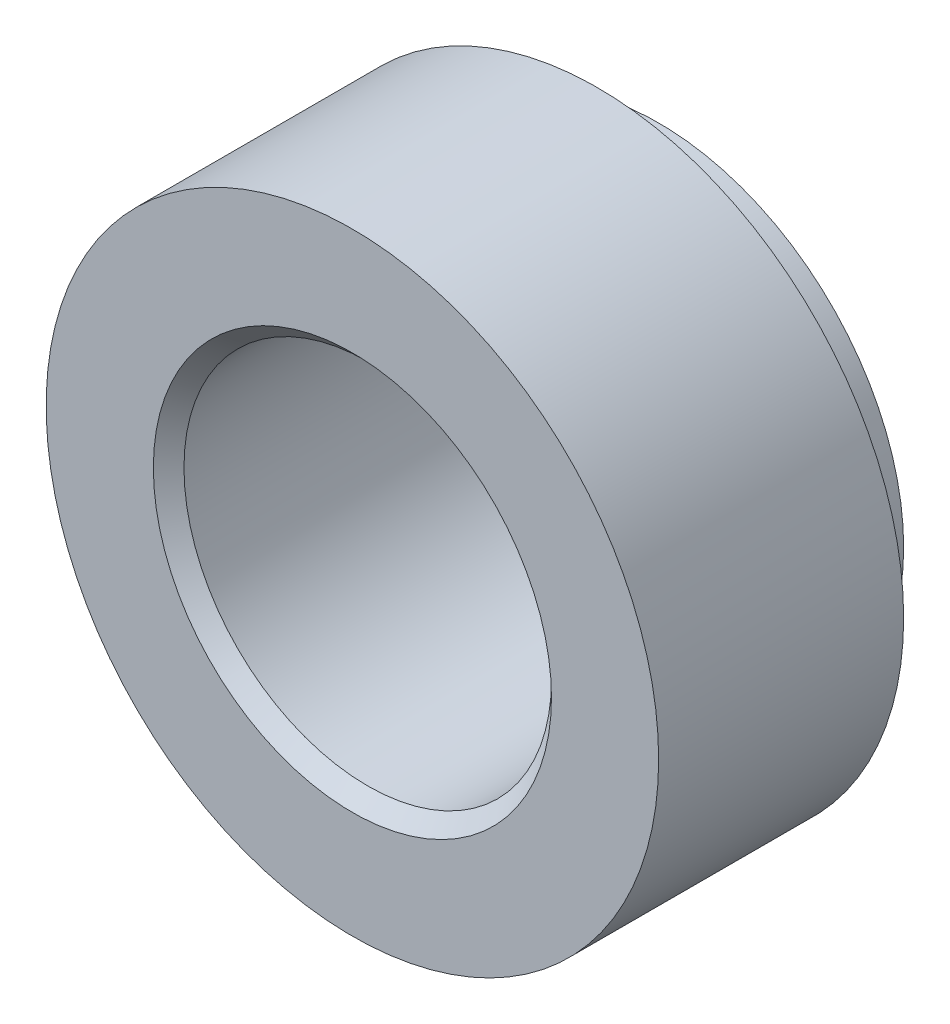
from build123d import *

# Parameters (mm, degrees)
CHAMFER1_SIZE = 1.5875


with BuildPart() as part:
    # Sketch1 → Revolve1 (revolve)
    with BuildSketch(Plane(origin=(0, 0, 0), x_dir=(0, 0, -1), z_dir=(1, 0, 0)), mode=Mode.PRIVATE) as revolve1_sk:
        Polygon((0, 19.05), (0, 31.75), (25.4, 31.75), (25.4, 25.4), (31.75, 25.4), (31.75, 19.05), align=None)
    revolve(revolve1_sk.sketch.rotate(Axis((0, 0, 0), (0, 0, -1)), 90), axis=Axis((0, 0, 0), (0, 0, -1)))

    # Chamfer1
    chamfer1_edges = [part.edges().sort_by_distance(p)[0] for p in [
        (-19.05, 0, -31.75),
        (-19.05, 0, 0),
    ]]
    chamfer(chamfer1_edges, length=CHAMFER1_SIZE)


solid = part.part
